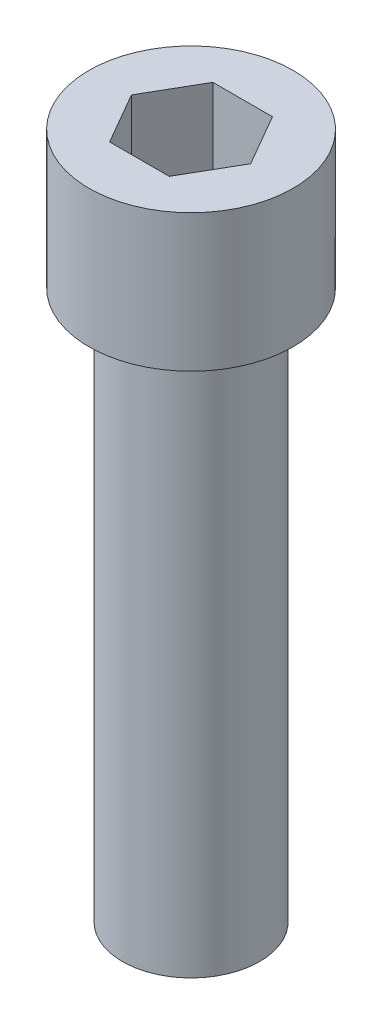
from build123d import *

# Parameters (mm, degrees)
HEX_CUT_DEPTH = 3.81


with BuildPart() as part:
    # Sketch1 → Screw revolve (revolve)
    with BuildSketch(Plane.XY, mode=Mode.PRIVATE) as screw_revolve_sk:
        Polygon((0, 0), (3.175, 0), (3.175, 25.4), (4.7244, 25.4), (4.7244, 31.75), (0, 31.75), align=None)
    revolve(screw_revolve_sk.sketch.rotate(Axis((0, 0, 0), (0, 1, 0)), 90), axis=Axis((0, 0, 0), (0, 1, 0)))

    # Sketch2 → Hex Cut (cut)
    with BuildSketch(Plane(origin=(0, 31.75, 0), x_dir=(-1, 0, 0), z_dir=(0, 1, 0))):
        Polygon((-2.756963005, 0), (-1.378481503, -2.3876), (1.378481503, -2.3876), (2.756963005, 0), (1.378481503, 2.3876), (-1.378481503, 2.3876), align=None)
    extrude(amount=-HEX_CUT_DEPTH, mode=Mode.SUBTRACT)


solid = part.part
